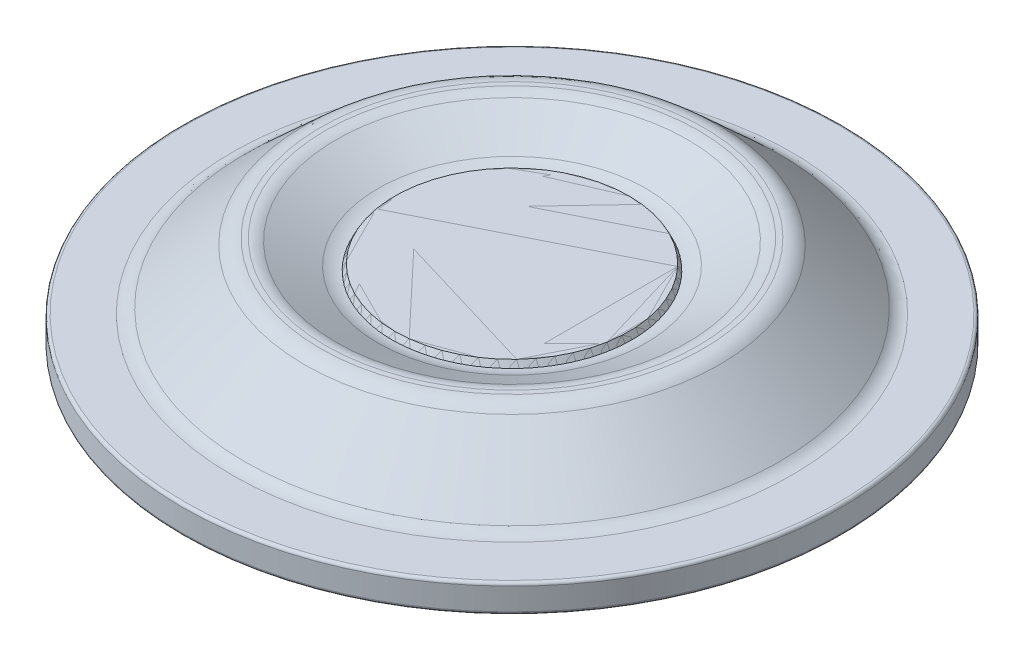
from build123d import *


with BuildPart() as part:
    # Sketch2 → Revolve1 (revolve)
    with BuildSketch(Plane.XY, mode=Mode.PRIVATE) as revolve1_sk:
        with BuildLine():
            Line((29.983650495, -0.443867684), (22.87071544, -4.1069567))
            ThreePointArc((22.87071544, -4.1069567), (21.718579032, -4.567119559), (20.5, -4.8))
            Line((20.5, -4.8), (20, -3.8))
            Line((20, -3.8), (0, -3.8))
            Line((0, -3.8), (0, -9.3))
            Line((0, -9.3), (15, -9.3))
            ThreePointArc((15, -9.3), (16.457793612, -9.125858931), (17.833549618, -8.613235546))
            Line((17.833549618, -8.613235546), (29.962411079, -2.366995583))
            ThreePointArc((29.962411079, -2.366995583), (32.619428304, -1.907384286), (35.062185326, -3.04927798))
            Line((35.062185326, -3.04927798), (44.201466627, -11.420466384))
            ThreePointArc((44.201466627, -11.420466384), (45.846371747, -12.442986109), (47.75, -12.8))
            Line((47.75, -12.8), (51, -12.8))
            ThreePointArc((51, -12.8), (51.353553391, -12.946446609), (51.5, -13.3))
            Line((51.5, -13.3), (51.5, -15.25))
            ThreePointArc((51.5, -15.25), (51.719669914, -15.780330086), (52.25, -16))
            Line((52.25, -16), (55.75, -16))
            ThreePointArc((55.75, -16), (56.103553391, -15.853553391), (56.25, -15.5))
            Line((56.25, -15.5), (56.25, -11.7))
            ThreePointArc((56.25, -11.7), (56.103553391, -11.346446609), (55.75, -11.2))
            Line((55.75, -11.2), (47.75, -11.2))
            ThreePointArc((47.75, -11.2), (46.564111626, -10.977593854), (45.539397974, -10.340602754))
            Line((45.539397974, -10.340602754), (35.396714268, -1.050340926))
            ThreePointArc((35.396714268, -1.050340926), (34.144326399, -0.271821068), (32.694953482, 0))
            Line((32.694953482, 0), (31.815022372, 0))
            ThreePointArc((31.815022372, 0), (30.872825276, -0.112550369), (29.983650495, -0.443867684))
        make_face()
    revolve(revolve1_sk.sketch.rotate(Axis((0, 0, 0), (0, -1, 0)), 90), axis=Axis((0, 0, 0), (0, -1, 0)))


with BuildPart() as body_2:
    # Sketch3 → Revolve2 (revolve)
    with BuildSketch(Plane.XY, mode=Mode.PRIVATE) as revolve2_sk:
        Polygon((20.5, -4.8), (14.084525297, -5.4), (0, -5.4), (0, -3.8), (20, -3.8), align=None)
    revolve(revolve2_sk.sketch.rotate(Axis((0, -20.910354892, 0), (0, 1, 0)), 90), axis=Axis((0, -20.910354892, 0), (0, 1, 0)))


solid = Compound([part.part, body_2.part])
